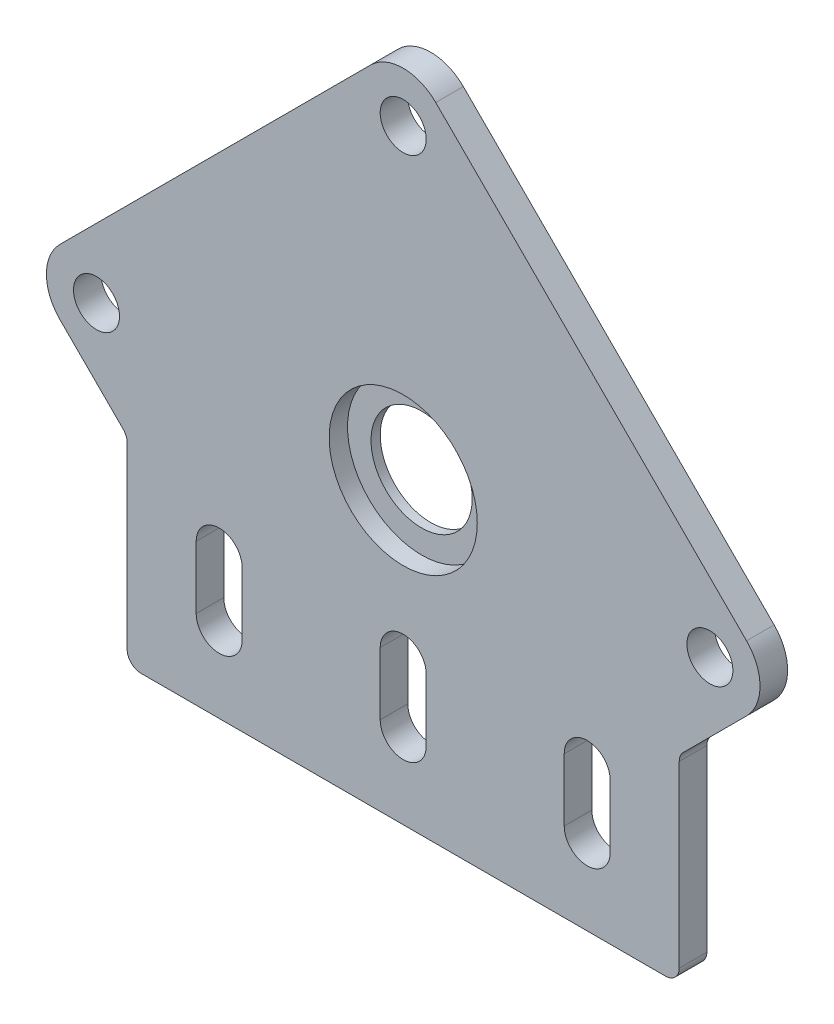
from build123d import *

# Parameters (mm, degrees)
MODEL_R             = 5.5
MODEL_R_2           = 2.5
BOSS_EXTRUDE1_DEPTH = 3
SKETCH2_R           = 8.05
CUT_EXTRUDE1_DEPTH  = 2


with BuildPart() as part:
    # Model → Boss-Extrude1 (new body)
    with BuildSketch(Plane.XY):
        with BuildLine():
            Line((-28.5, 0), (28.5, 0))
            ThreePointArc((28.5, 0), (29.560660172, 0.439339828), (30, 1.5))
            Line((30, 1.5), (30, 20.959120907))
            ThreePointArc((30, 20.959120907), (30.114180701, 21.533146056), (30.439339828, 22.019781079))
            Line((30.439339828, 22.019781079), (37.314024843, 28.894466094))
            ThreePointArc((37.314024843, 28.894466094), (38.778490937, 32.43), (37.314024843, 35.965533906))
            Line((37.314024843, 35.965533906), (3.535533906, 69.744024843))
            ThreePointArc((3.535533906, 69.744024843), (0, 71.208490937), (-3.535533906, 69.744024843))
            Line((-3.535533906, 69.744024843), (-37.314024843, 35.965533906))
            ThreePointArc((-37.314024843, 35.965533906), (-38.778490937, 32.43), (-37.314024843, 28.894466094))
            Line((-37.314024843, 28.894466094), (-30.439339828, 22.019781079))
            ThreePointArc((-30.439339828, 22.019781079), (-30.114180701, 21.533146056), (-30, 20.959120907))
            Line((-30, 20.959120907), (-30, 1.5))
            ThreePointArc((-30, 1.5), (-29.560660172, 0.439339828), (-28.5, 0))
        make_face()
        with Locations((0, 32.43)):
            Circle(MODEL_R, mode=Mode.SUBTRACT)
        with Locations((0, 65.76302733)):
            Circle(MODEL_R_2, mode=Mode.SUBTRACT)
        with Locations(Location((33.333, 32.43, 0), (0, 0, 180))):
            Circle(MODEL_R_2, mode=Mode.SUBTRACT)
        with Locations((-33.333, 32.43)):
            Circle(MODEL_R_2, mode=Mode.SUBTRACT)
        with BuildLine():
            Line((22.5, 8.63), (22.5, 15.43))
            ThreePointArc((22.5, 15.43), (20, 17.93), (17.5, 15.43))
            Line((17.5, 15.43), (17.5, 8.63))
            ThreePointArc((17.5, 8.63), (20, 6.13), (22.5, 8.63))
        make_face(mode=Mode.SUBTRACT)
        with BuildLine():
            Line((-22.5, 8.63), (-22.5, 15.43))
            ThreePointArc((-22.5, 15.43), (-20, 17.93), (-17.5, 15.43))
            Line((-17.5, 15.43), (-17.5, 8.63))
            ThreePointArc((-17.5, 8.63), (-20, 6.13), (-22.5, 8.63))
        make_face(mode=Mode.SUBTRACT)
        with BuildLine():
            Line((-2.5, 8.63), (-2.5, 15.43))
            ThreePointArc((-2.5, 15.43), (0, 17.93), (2.5, 15.43))
            Line((2.5, 15.43), (2.5, 8.63))
            ThreePointArc((2.5, 8.63), (0, 6.13), (-2.5, 8.63))
        make_face(mode=Mode.SUBTRACT)
    extrude(amount=BOSS_EXTRUDE1_DEPTH)

    # Sketch2 → Cut-Extrude1 (cut)
    with BuildSketch(Plane.XY.offset(3)):
        with Locations((0, 32.43)):
            Circle(SKETCH2_R)
    extrude(amount=-CUT_EXTRUDE1_DEPTH, mode=Mode.SUBTRACT)


solid = part.part
